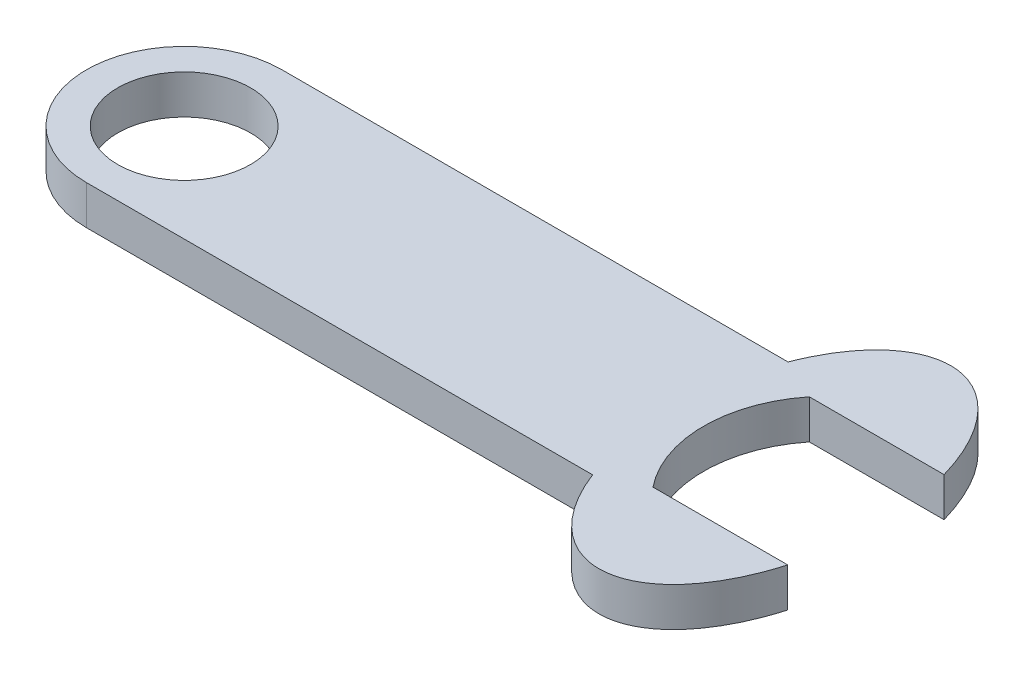
from build123d import *

# Parameters (mm, degrees)
SKETCH3_R           = 17
BOSS_EXTRUDE1_DEPTH = 10


with BuildPart() as part:
    # Sketch3 → Boss-Extrude1 (new body)
    with BuildSketch(Plane(origin=(0, 0, 0), x_dir=(1, 0, 0), z_dir=(0, 1, 0))):
        with BuildLine():
            Line((-151.1, 25), (-21.618464901, 25))
            add(Edge.make_bspline(
                [(23.290966828, 20), (3.331219393, 89.629118064), (-21.618464901, 25)],
                knots=[2.031350318, 2.031350318, 2.031350318, 4.12335801, 4.12335801, 4.12335801], degree=2, weights=[1, 0.501033423, 1]))
            Line((23.290966828, 20), (-11.179991994, 20))
            ThreePointArc((-11.179991994, 20), (-18.2, 0), (-11.179991994, -20))
            Line((-11.179991994, -20), (23.290966828, -20))
            add(Edge.make_bspline(
                [(-21.618464901, -25), (3.331219393, -89.629118064), (23.290966828, -20)],
                knots=[5.301419951, 5.301419951, 5.301419951, 7.393427642, 7.393427642, 7.393427642], degree=2, weights=[1, 0.501033423, 1]))
            Line((-21.618464901, -25), (-151.1, -25))
            ThreePointArc((-151.1, -25), (-176.1, 0), (-151.1, 25))
        make_face()
        with Locations(Location((-151.1, 0, 0), (0, 0, 270))):
            Circle(SKETCH3_R, mode=Mode.SUBTRACT)
    extrude(amount=BOSS_EXTRUDE1_DEPTH)


solid = part.part
